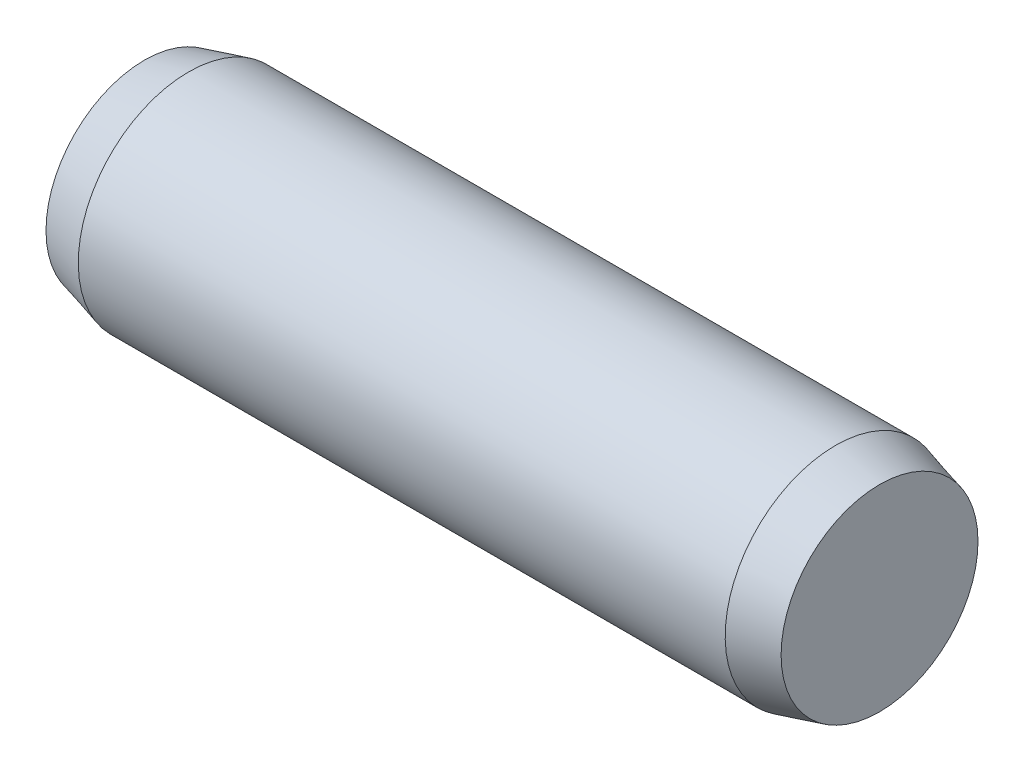
from build123d import *


with BuildPart() as part:
    # Skica1 → Otočit kolem osy1 (revolve)
    with BuildSketch(Plane.XY):
        Polygon((0, 0), (0, 0.267846097), (0.12, 0.3), (1.88, 0.3), (2, 0.267846097), (2, 0), align=None)
    revolve(axis=Axis((2, 0, 0), (-1, 0, 0)))


solid = part.part
